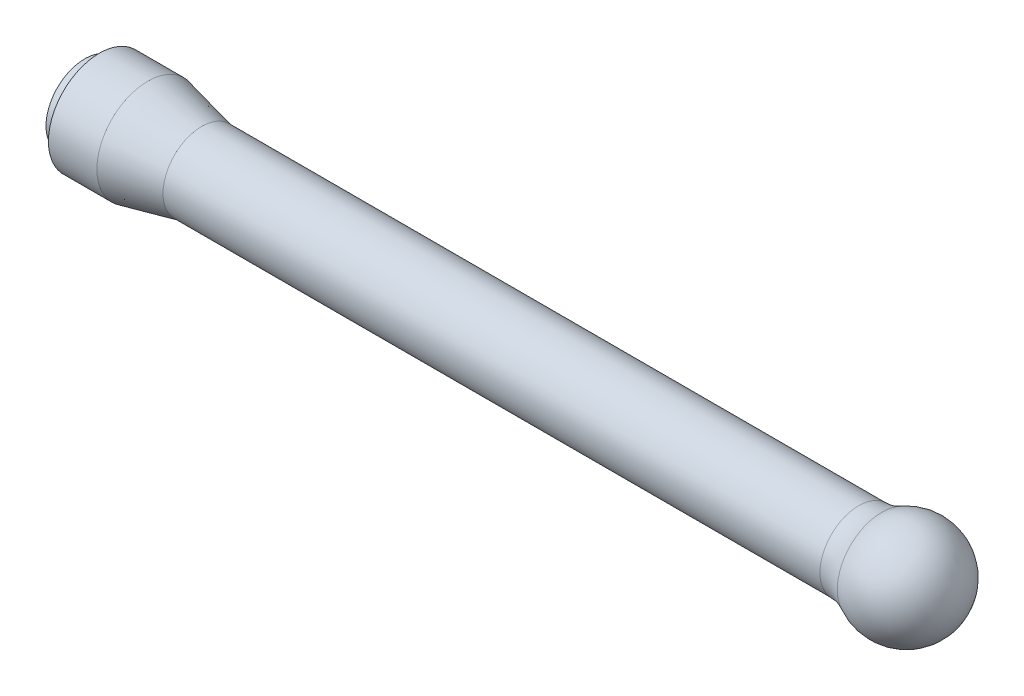
from build123d import *

# Parameters (mm, degrees)
R_P_TITION_CIRCULAIRE1_COUNT = 3
CONG_1_R                     = 10


with BuildPart() as part:
    # Esquisse1 → Révolution1 (revolve)
    with BuildSketch(Plane.XY, mode=Mode.PRIVATE) as r_volution1_sk:
        with BuildLine():
            Line((0, 0), (0, 8))
            Line((0, 8), (3, 8))
            Line((3, 8), (3, 10.5))
            Line((3, 10.5), (13, 10.5))
            Line((13, 10.5), (24.141100896, 8))
            Line((24.141100896, 8), (162.699264746, 8))
            ThreePointArc((162.699264746, 8), (173.906942241, 9.530417624), (180, 0))
            Line((180, 0), (0, 0))
        make_face()
    revolve(r_volution1_sk.sketch.rotate(Axis((-57.132155607, 0, 0), (1, 0, 0)), 90), axis=Axis((-57.132155607, 0, 0), (1, 0, 0)))

    # Esquisse4 → Trou taraudé M2.51 (revolve, cut)
    with BuildSketch(Plane.ZX.offset(5.5)):
        Polygon((0, 0), (0, 5.115882135), (1.025, 4.5), (1.025, 0.325), (1.35, 0), align=None)
    trou_taraud_m2_51 = revolve(axis=Axis((-6.35, 5.5, 0), (1, 0, 0)), mode=Mode.SUBTRACT)

    # Répétition circulaire1: Trou taraudé M2.51 ×3 about axis
    r_p_tition_circulaire1_axis = Axis((0, 0, 0), (1, 0, 0))
    for i in range(1, R_P_TITION_CIRCULAIRE1_COUNT):
        add(trou_taraud_m2_51.rotate(r_p_tition_circulaire1_axis, i * 360 / R_P_TITION_CIRCULAIRE1_COUNT), mode=Mode.SUBTRACT)

    # Congé1
    cong_1_edges = [part.edges().sort_by_distance(p)[0] for p in [
        (162.699264746, 0, -8),
    ]]
    fillet(cong_1_edges, radius=CONG_1_R)


solid = part.part
